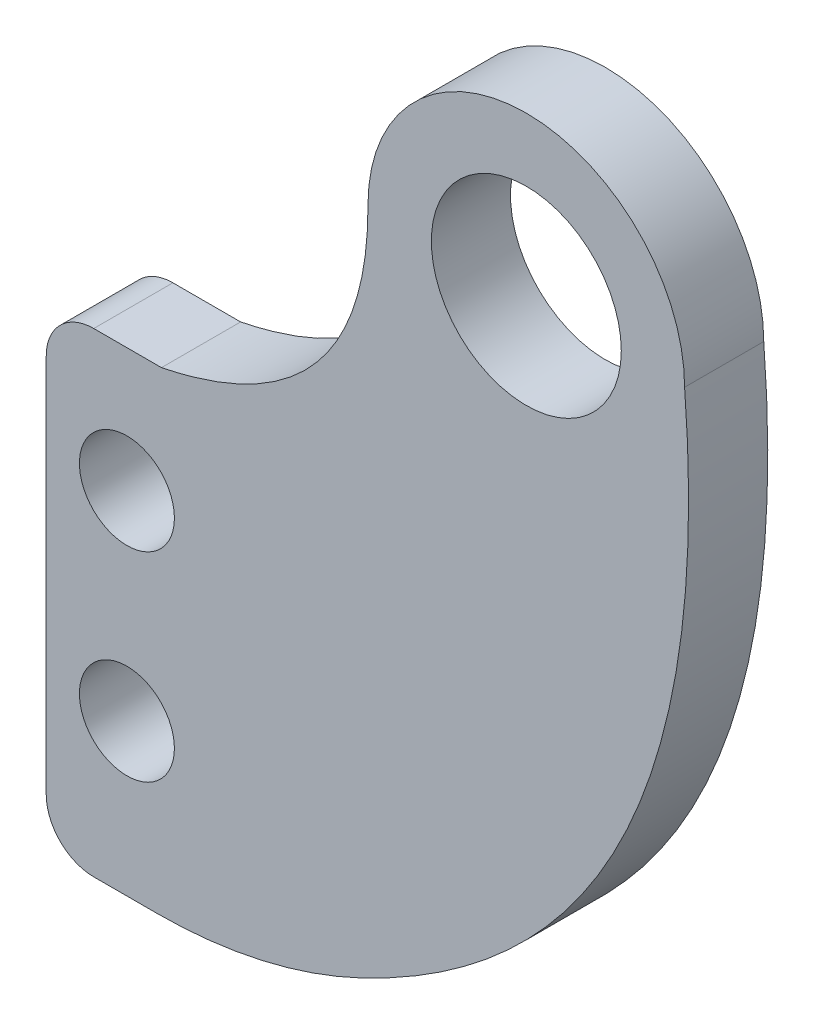
from build123d import *

# Parameters (mm, degrees)
SKETCH1_R           = 3
SKETCH1_R_2         = 6
BOSS_EXTRUDE1_DEPTH = 5
FILLET1_R           = 30
FILLET3_R           = 3
FILLET4_R           = 3


with BuildPart() as part:
    # Sketch1 → Boss-Extrude1 (new body)
    with BuildSketch(Plane.XY):
        with BuildLine():
            Line((685.352484273, 879.16298506), (685.352484273, 849.16298506))
            Line((685.352484273, 849.16298506), (697.448463409, 849.16298506))
            add(Edge.make_bspline(
                [(697.448463409, 849.16298506), (728.616221011, 858.08895863), (725.678478781, 894.611707807)],
                knots=[0, 0, 0, 1, 1, 1], degree=2))
            ThreePointArc((725.678478781, 894.611707807), (715.678478781, 904.611707807), (705.678478781, 894.611707807))
            ThreePointArc((705.678478781, 894.611707807), (705.67849738, 894.592421342), (705.678553175, 894.573134948))
            add(Edge.make_bspline(
                [(705.678553175, 894.573134948), (705.693307068, 881.810970257), (692.631868047, 879.16298506)],
                knots=[0.001508038, 0.001508038, 0.001508038, 1, 1, 1], degree=2))
            Line((692.631868047, 879.16298506), (685.352484273, 879.16298506))
        make_face()
        with Locations((690.448463409, 858.739216263)):
            Circle(SKETCH1_R, mode=Mode.SUBTRACT)
        with Locations((690.448463409, 871.339216263)):
            Circle(SKETCH1_R, mode=Mode.SUBTRACT)
        with Locations((715.678478781, 894.611707807)):
            Circle(SKETCH1_R_2, mode=Mode.SUBTRACT)
    extrude(amount=BOSS_EXTRUDE1_DEPTH)

    # Fillet1
    fillet1_edges = [part.edges().sort_by_distance(p)[0] for p in [
        (697.448463409, 849.16298506, 2.5),
    ]]
    fillet(fillet1_edges, radius=FILLET1_R)

    # Fillet3
    fillet3_edges = [part.edges().sort_by_distance(p)[0] for p in [
        (685.352484273, 879.16298506, 2.5),
    ]]
    fillet(fillet3_edges, radius=FILLET3_R)

    # Fillet4
    fillet4_edges = [part.edges().sort_by_distance(p)[0] for p in [
        (685.352484273, 849.16298506, 2.5),
    ]]
    fillet(fillet4_edges, radius=FILLET4_R)


solid = part.part
